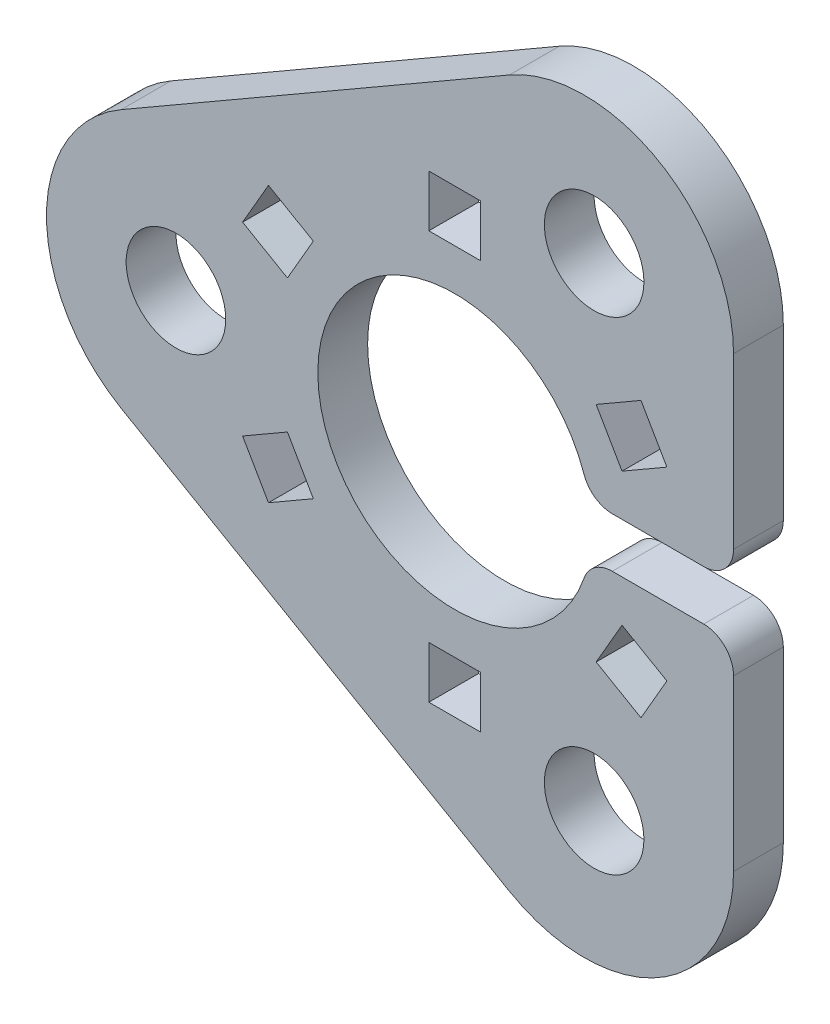
from build123d import *

# Parameters (mm, degrees)
SKETCH1_R           = 5
SKETCH1_W           = 5.2
SKETCH1_H           = 5.2
BOSS_EXTRUDE1_DEPTH = 5
CONG_1_R            = 15
CONG_2_R            = 3


with BuildPart() as part:
    # Sketch1 → Boss-Extrude1 (new body)
    with BuildSketch(Plane.XY):
        with BuildLine():
            Line((28, 2.5), (13.520817283, 2.5))
            ThreePointArc((13.520817283, 2.5), (-13.75, 0), (13.520817283, -2.5))
            Line((13.520817283, -2.5), (28, -2.5))
            Line((28, -2.5), (28, -48.497422612))
            Line((28, -48.497422612), (-56, 0))
            Line((-56, 0), (28, 48.497422612))
            Line((28, 48.497422612), (28, 2.5))
        make_face()
        with Locations((14, 24.248711306)):
            Circle(SKETCH1_R, mode=Mode.SUBTRACT)
        with Locations((14, -24.248711306)):
            Circle(SKETCH1_R, mode=Mode.SUBTRACT)
        with Locations((-28, 0)):
            Circle(SKETCH1_R, mode=Mode.SUBTRACT)
        with Locations((0, 20.5)):
            Rectangle(SKETCH1_W, SKETCH1_H, mode=Mode.SUBTRACT)
        Polygon((21.305186827, 9.29833395), (16.801854728, 6.69833395), (14.201854728, 11.20166605), (18.705186827, 13.80166605), align=None, mode=Mode.SUBTRACT)
        Polygon((18.705186827, -13.80166605), (14.201854728, -11.20166605), (16.801854728, -6.69833395), (21.305186827, -9.29833395), align=None, mode=Mode.SUBTRACT)
        with Locations((0, -20.5)):
            Rectangle(SKETCH1_W, SKETCH1_H, mode=Mode.SUBTRACT)
        Polygon((-21.305186827, -9.29833395), (-16.801854728, -6.69833395), (-14.201854728, -11.20166605), (-18.705186827, -13.80166605), align=None, mode=Mode.SUBTRACT)
        Polygon((-18.705186827, 13.80166605), (-14.201854728, 11.20166605), (-16.801854728, 6.69833395), (-21.305186827, 9.29833395), align=None, mode=Mode.SUBTRACT)
    extrude(amount=BOSS_EXTRUDE1_DEPTH)

    # Congé1
    cong_1_edges = [part.edges().sort_by_distance(p)[0] for p in [
        (28, -48.497422612, 2.5),
        (-56, 0, 2.5),
        (28, 48.497422612, 2.5),
    ]]
    fillet(cong_1_edges, radius=CONG_1_R)

    # Congé2
    cong_2_edges = [part.edges().sort_by_distance(p)[0] for p in [
        (28, 2.5, 2.5),
        (13.520817283, 2.5, 2.5),
        (13.520817283, -2.5, 2.5),
        (28, -2.5, 2.5),
    ]]
    fillet(cong_2_edges, radius=CONG_2_R)


solid = part.part
